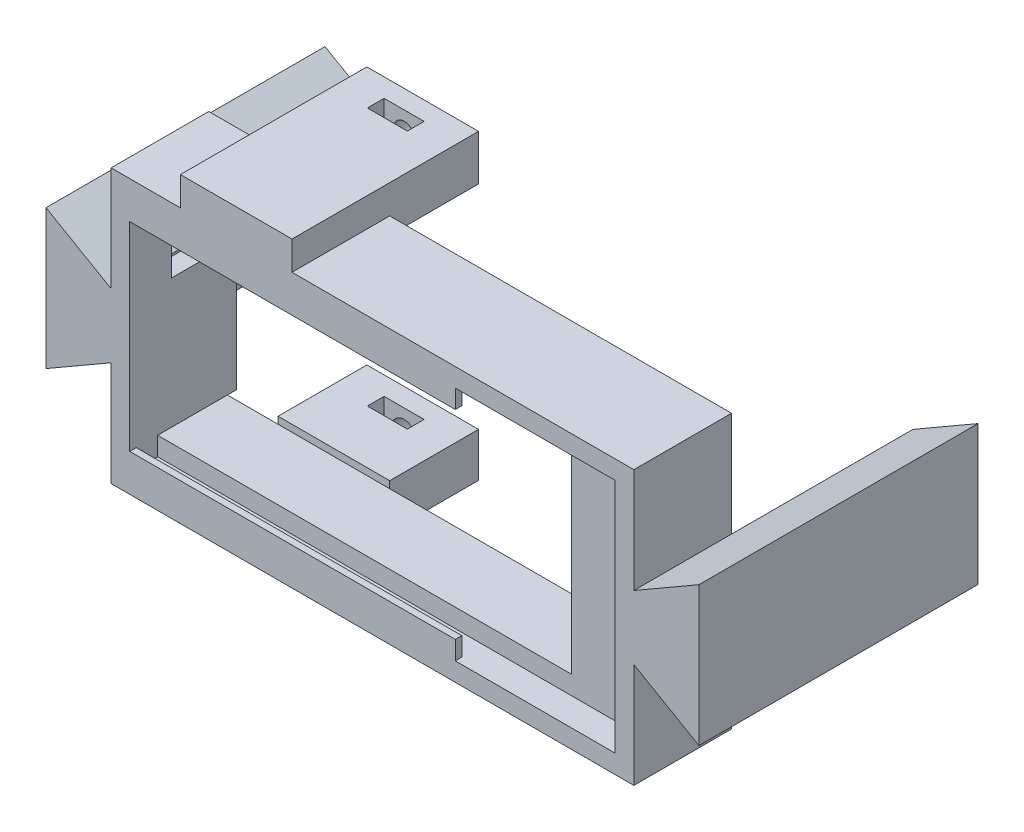
from build123d import *

# Parameters (mm, degrees)
SKETCH1_W                = 52.2
SKETCH1_H                = 25.4
SKETCH1_W_2              = 48.2
SKETCH1_H_2              = 21.4
SKETCH1_W_3              = 5.7
BOSS_EXTRUDE1_DEPTH      = 7.5
BOSS_EXTRUDE2_DEPTH      = 3
BOSS_EXTRUDE2_DEPTH_BACK = 7.5
SKETCH2_W                = 56.2
SKETCH2_H                = 29.4
SKETCH2_W_2              = 52.2
SKETCH2_H_2              = 25.4
BOSS_EXTRUDE5_DEPTH      = 30
BOSS_EXTRUDE12_DEPTH     = 12
CUT_EXTRUDE2_DEPTH       = 16
CUT_EXTRUDE3_REACH       = 53.658
SKETCH12_W               = 4.3
SKETCH12_H               = 1.8
SKETCH13_W               = 9.55
SKETCH13_H               = 4.75
BOSS_EXTRUDE14_DEPTH     = 12
SKETCH14_R               = 1.3
CUT_EXTRUDE4_DEPTH       = 16
SKETCH15_W               = 4.3
SKETCH15_H               = 1.8
CUT_EXTRUDE5_DEPTH       = 10
SKETCH16_W               = 4
SKETCH16_H               = 21.4
CUT_EXTRUDE6_DEPTH       = 4
SKETCH17_W               = 35
SKETCH17_H               = 2
BOSS_EXTRUDE15_DEPTH     = 0.7
SKETCH18_R               = 1.3
CUT_EXTRUDE7_DEPTH       = 6
SKETCH19_W               = 2
SKETCH19_H               = 21.4
CUT_EXTRUDE8_DEPTH       = 14
SKETCH20_W               = 2
SKETCH20_H               = 7.5
CUT_EXTRUDE9_DEPTH       = 2
BOSS_EXTRUDE16_DEPTH     = 5


with BuildPart() as part:
    # Sketch1 → Boss-Extrude1 (new body)
    # profile 1 of 2: a face of its own
    with BuildSketch(Plane.XY):
        Rectangle(SKETCH1_W, SKETCH1_H)
        Rectangle(SKETCH1_W_2, SKETCH1_H_2, mode=Mode.SUBTRACT)
    # profile 2 of 2: a face of its own
    with BuildSketch(Plane.XY):
        with Locations((21.25, 0)):
            Rectangle(SKETCH1_W_3, SKETCH1_H_2)
    extrude(amount=BOSS_EXTRUDE1_DEPTH)

    # Sketch2 → Boss-Extrude2 (add, two sides: drawn at the far end of the back side and taken through both)
    with BuildSketch(Plane.XY.offset(7.5).offset(-BOSS_EXTRUDE2_DEPTH_BACK)):
        Rectangle(SKETCH2_W, SKETCH2_H)
        Rectangle(SKETCH2_W_2, SKETCH2_H_2, mode=Mode.SUBTRACT)
    extrude(amount=BOSS_EXTRUDE2_DEPTH + BOSS_EXTRUDE2_DEPTH_BACK)

    # Sketch6 → Boss-Extrude5 (add)
    with BuildSketch(Plane.XY.offset(10.5)):
        Polygon((-28.1, 3.45), (-35.1, 7.491451884), (-35.1, -7.491451884), (-28.1, -3.45), align=None)
    boss_extrude5 = extrude(amount=-BOSS_EXTRUDE5_DEPTH)

    # Mirror1: Boss-Extrude5 across plane
    add(boss_extrude5.mirror(Plane(origin=(0, 0, 0), x_dir=(0, 0, 1), z_dir=(1, 0, 0))))

    # Sketch10 → Boss-Extrude12 (add)
    with BuildSketch(Plane(origin=(-8.65, 0, 0), x_dir=(0, 0, -1), z_dir=(1, 0, 0))):
        Polygon((9.55, 12.9), (9.55, 17.8), (-10.5, 17.8), (-10.5, 14.7), (0, 14.7), (0, 12.9), align=None)
    extrude(amount=-BOSS_EXTRUDE12_DEPTH)

    # Sketch11 → Cut-Extrude2 (cut)
    with BuildSketch(Plane(origin=(0, 0, -9.55), x_dir=(-1, 0, 0), z_dir=(0, 0, -1))):
        with BuildLine():
            ThreePointArc((14.1, 16.6), (14.65, 16.747372056), (15.2, 16.6))
            ThreePointArc((15.2, 16.6), (14.65, 14.547372056), (14.1, 16.6))
        make_face()
    extrude(amount=-CUT_EXTRUDE2_DEPTH, mode=Mode.SUBTRACT)

    # Sketch12 → Cut-Extrude3 (cut, up to next)
    with BuildSketch(Plane(origin=(0, 17.8, 0), x_dir=(1, 0, 0), z_dir=(0, 1, 0)), mode=Mode.PRIVATE) as cut_extrude3_sk1:
        with Locations((-14.65, 6.65)):
            Rectangle(SKETCH12_W, SKETCH12_H)
    cut_extrude3_tool1 = extrude(cut_extrude3_sk1.sketch, amount=-CUT_EXTRUDE3_REACH, mode=Mode.PRIVATE) & part.part
    add(cut_extrude3_tool1.solids().sort_by_distance((-14.65, 17.8, -6.65))[0], mode=Mode.SUBTRACT)

    # Sketch16 → Cut-Extrude6 (cut)
    with BuildSketch(Plane(origin=(0, 0, 0), x_dir=(-1, 0, 0), z_dir=(0, 0, -1))):
        with Locations((26.1, 0)):
            Rectangle(SKETCH16_W, SKETCH16_H)
    extrude(amount=-CUT_EXTRUDE6_DEPTH, mode=Mode.SUBTRACT)

    # Sketch17 → Boss-Extrude15 (add)
    with BuildSketch(Plane.XY.offset(10.5)):
        with Locations((-8.6, 11.7)):
            Rectangle(SKETCH17_W, SKETCH17_H)
        with Locations((-8.6, -11.7)):
            Rectangle(SKETCH17_W, SKETCH17_H)
    extrude(amount=-BOSS_EXTRUDE15_DEPTH)

    # Sketch18 → Cut-Extrude7 (cut)
    with BuildSketch(Plane(origin=(0, 0, 0), x_dir=(-1, 0, 0), z_dir=(0, 0, -1))):
        with Locations((14.65, -12.322078101)):
            Circle(SKETCH18_R)
    extrude(amount=-CUT_EXTRUDE7_DEPTH, mode=Mode.SUBTRACT)

    # Sketch19 → Cut-Extrude8 (cut)
    with BuildSketch(Plane.XY.offset(7.5)):
        with Locations((-25.1, 0)):
            Rectangle(SKETCH19_W, SKETCH19_H)
    extrude(amount=-CUT_EXTRUDE8_DEPTH, mode=Mode.SUBTRACT)

    # Sketch20 → Cut-Extrude9 (cut)
    with BuildSketch(Plane(origin=(0, 0, 4), x_dir=(-1, 0, 0), z_dir=(0, 0, -1))):
        with Locations((27.1, 6.95)):
            Rectangle(SKETCH20_W, SKETCH20_H)
    extrude(amount=-CUT_EXTRUDE9_DEPTH, mode=Mode.SUBTRACT)

    # Sketch21 → Boss-Extrude16 (add)
    with BuildSketch(Plane(origin=(0, 0, 4), x_dir=(-1, 0, 0), z_dir=(0, 0, -1))):
        Polygon((28.1, -10.7), (28.1, -3.45), (28.1, 3.2), (26.1, 3.2), (26.1, -10.7), align=None)
    extrude(amount=BOSS_EXTRUDE16_DEPTH)


with BuildPart() as body_2:
    # Sketch13 → Boss-Extrude14 (new body)
    with BuildSketch(Plane(origin=(-8.65, 0, 0), x_dir=(0, 0, -1), z_dir=(1, 0, 0))):
        with Locations((4.775, -12.325)):
            Rectangle(SKETCH13_W, SKETCH13_H)
    extrude(amount=-BOSS_EXTRUDE14_DEPTH)

    # Sketch14 → Cut-Extrude4 (cut)
    with BuildSketch(Plane(origin=(0, 0, -9.55), x_dir=(-1, 0, 0), z_dir=(0, 0, -1))):
        with Locations((14.65, -12.322078101)):
            Circle(SKETCH14_R)
    extrude(amount=-CUT_EXTRUDE4_DEPTH, mode=Mode.SUBTRACT)

    # Sketch15 → Cut-Extrude5 (cut)
    with BuildSketch(Plane.XZ.offset(14.7)):
        with Locations((-14.65, -6.65)):
            Rectangle(SKETCH15_W, SKETCH15_H)
    extrude(amount=-CUT_EXTRUDE5_DEPTH, mode=Mode.SUBTRACT)


solid = Compound([part.part, body_2.part])
